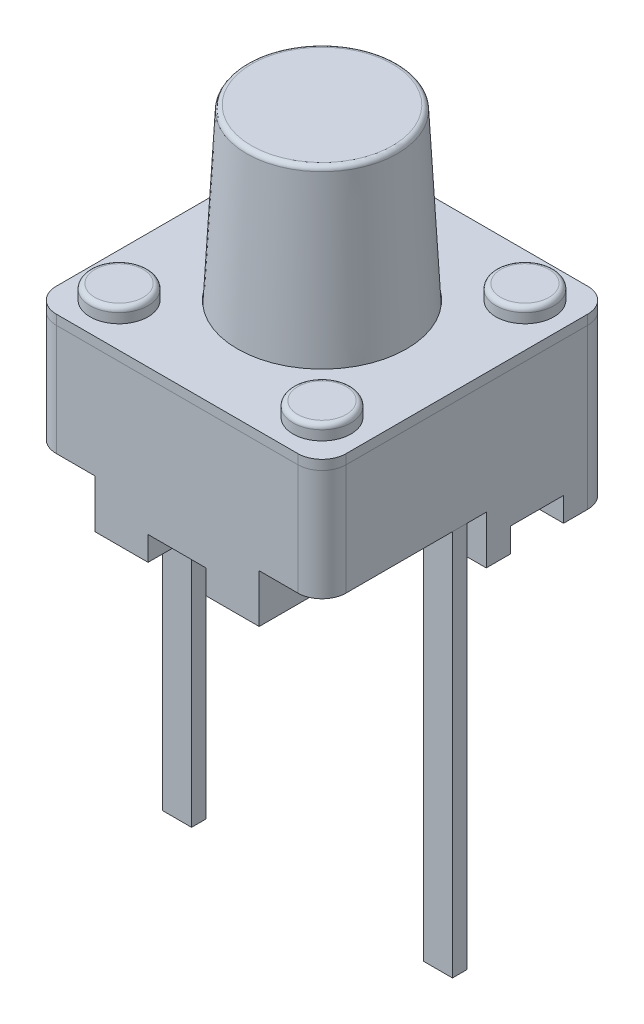
from build123d import *

# Parameters (mm, degrees)
SKETCH1_W                 = 0.6
SKETCH1_H                 = 0.3
SKETCH1_R                 = 0.6
SKETCH1_R_2               = 1.75
BASE_DEPTH                = 3.3
TOP_START                 = 3.3
SKETCH1_3_R               = 0.6
SKETCH1_3_R_2             = 1.75
SKETCH1_3_W               = 0.6
SKETCH1_3_H               = 0.3
TOP_PLATE_DEPTH           = 0.2
KNOBS_START               = 3.3
SKETCH1_4_R               = 0.6
KNOBS_DEPTH               = 0.5
ACTUATOR_START            = 3.3
SKETCH1_5_R               = 1.75
ACTUATOR_DEPTH            = 3.7
ACTUATOR_TAPER            = 3
BASE_LEG_CUTOUT_DEPTH     = 1
SKETCH2_3_W               = 1.2
SKETCH2_3_H               = 6
SKETCH2_3_W_2             = 1.3
SKETCH2_3_H_2             = 1.1
BASE_SHALLOW_CUTOUT_DEPTH = 0.5
PINS_START                = 1
SKETCH1_7_W               = 0.6
SKETCH1_7_H               = 0.3
PINS_DEPTH                = 8
PINS_2_DEPTH              = 8
FILLET1_R                 = 0.1
FILLET2_R                 = 0.1


with BuildPart() as part:
    # Sketch1 → Base (new body)
    # profile 1 of 8: a face of its own
    with BuildSketch(Plane(origin=(0, 0, 0), x_dir=(1, 0, 0), z_dir=(0, 1, 0))):
        with Locations((-2.7, -0.15)):
            Rectangle(SKETCH1_W, SKETCH1_H)
    # profile 2 of 8: a face of its own
    with BuildSketch(Plane(origin=(0, 0, 0), x_dir=(1, 0, 0), z_dir=(0, 1, 0))):
        with BuildLine():
            Line((2.5, 3), (-2.5, 3))
            ThreePointArc((-2.5, 3), (-2.853553391, 2.853553391), (-3, 2.5))
            Line((-3, 2.5), (-3, 0))
            Line((-3, 0), (-2.4, 0))
            Line((-2.4, 0), (-2.4, -0.3))
            Line((-2.4, -0.3), (-3, -0.3))
            Line((-3, -0.3), (-3, -2.5))
            ThreePointArc((-3, -2.5), (-2.853553391, -2.853553391), (-2.5, -3))
            Line((-2.5, -3), (2.5, -3))
            ThreePointArc((2.5, -3), (2.853553391, -2.853553391), (3, -2.5))
            Line((3, -2.5), (3, -0.3))
            Line((3, -0.3), (2.4, -0.3))
            Line((2.4, -0.3), (2.4, 0))
            Line((2.4, 0), (3, 0))
            Line((3, 0), (3, 2.5))
            ThreePointArc((3, 2.5), (2.853553391, 2.853553391), (2.5, 3))
        make_face()
        with Locations((-2.1, -2.1)):
            Circle(SKETCH1_R, mode=Mode.SUBTRACT)
        Circle(SKETCH1_R_2, mode=Mode.SUBTRACT)
        with Locations((2.1, -2.1)):
            Circle(SKETCH1_R, mode=Mode.SUBTRACT)
        with Locations((-2.1, 2.1)):
            Circle(SKETCH1_R, mode=Mode.SUBTRACT)
        with Locations((2.1, 2.1)):
            Circle(SKETCH1_R, mode=Mode.SUBTRACT)
    # profile 3 of 8: a face of its own
    with BuildSketch(Plane(origin=(0, 0, 0), x_dir=(1, 0, 0), z_dir=(0, 1, 0))):
        with Locations((-2.1, 2.1)):
            Circle(SKETCH1_R)
    # profile 4 of 8: a face of its own
    with BuildSketch(Plane(origin=(0, 0, 0), x_dir=(1, 0, 0), z_dir=(0, 1, 0))):
        with Locations((-2.1, -2.1)):
            Circle(SKETCH1_R)
    # profile 5 of 8: a face of its own
    with BuildSketch(Plane(origin=(0, 0, 0), x_dir=(1, 0, 0), z_dir=(0, 1, 0))):
        Circle(SKETCH1_R_2)
    # profile 6 of 8: a face of its own
    with BuildSketch(Plane(origin=(0, 0, 0), x_dir=(1, 0, 0), z_dir=(0, 1, 0))):
        with Locations((2.1, -2.1)):
            Circle(SKETCH1_R)
    # profile 7 of 8: a face of its own
    with BuildSketch(Plane(origin=(0, 0, 0), x_dir=(1, 0, 0), z_dir=(0, 1, 0))):
        with Locations((2.7, -0.15)):
            Rectangle(SKETCH1_W, SKETCH1_H)
    # profile 8 of 8: a face of its own
    with BuildSketch(Plane(origin=(0, 0, 0), x_dir=(1, 0, 0), z_dir=(0, 1, 0))):
        with Locations((2.1, 2.1)):
            Circle(SKETCH1_R)
    extrude(amount=BASE_DEPTH)

    # Sketch1<4> → Knobs (add)
    with BuildSketch(Plane(origin=(0, 0, 0), x_dir=(1, 0, 0), z_dir=(0, 1, 0)).offset(KNOBS_START)):
        with Locations(Location((2.1, -2.1, 0), (0, 0, 270))):
            Circle(SKETCH1_4_R)
        with Locations(Location((-2.1, -2.1, 0), (0, 0, 270))):
            Circle(SKETCH1_4_R)
        with Locations(Location((-2.1, 2.1, 0), (0, 0, 270))):
            Circle(SKETCH1_4_R)
        with Locations(Location((2.1, 2.1, 0), (0, 0, 270))):
            Circle(SKETCH1_4_R)
    extrude(amount=KNOBS_DEPTH)

    # Sketch2 → Base Leg Cutout (cut)
    with BuildSketch(Plane.XZ):
        with BuildLine():
            Line((-1.7, -0.4), (-1.7, 3))
            Line((-1.7, 3), (-2.5, 3))
            ThreePointArc((-2.5, 3), (-2.853553391, 2.853553391), (-3, 2.5))
            Line((-3, 2.5), (-3, -0.4))
            Line((-3, -0.4), (-1.7, -0.4))
        make_face()
        with BuildLine():
            Line((2.5, 3), (1.7, 3))
            Line((1.7, 3), (1.7, -0.4))
            Line((1.7, -0.4), (3, -0.4))
            Line((3, -0.4), (3, 2.5))
            ThreePointArc((3, 2.5), (2.853553391, 2.853553391), (2.5, 3))
        make_face()
    extrude(amount=-BASE_LEG_CUTOUT_DEPTH, mode=Mode.SUBTRACT)

    # Sketch2<3> → Base Shallow Cutout (cut)
    with BuildSketch(Plane.XZ):
        Rectangle(SKETCH2_3_W, SKETCH2_3_H)
        with Locations((2.35, -1.45)):
            Rectangle(SKETCH2_3_W_2, SKETCH2_3_H_2)
        with Locations((-2.35, -1.45)):
            Rectangle(SKETCH2_3_W_2, SKETCH2_3_H_2)
    extrude(amount=-BASE_SHALLOW_CUTOUT_DEPTH, mode=Mode.SUBTRACT)

    # Fillet2
    fillet2_edges = [part.edges().sort_by_distance(p)[0] for p in [
        (2.1, 3.8, 1.5),
        (-2.1, 3.8, 1.5),
        (-2.1, 3.8, -2.7),
        (2.1, 3.8, -2.7),
    ]]
    fillet(fillet2_edges, radius=FILLET2_R)


with BuildPart() as body_2:
    # Sketch1<3> → Top Plate (new body)
    # profile 1 of 3: a face of its own
    with BuildSketch(Plane(origin=(0, 0, 0), x_dir=(1, 0, 0), z_dir=(0, 1, 0)).offset(TOP_START)):
        with BuildLine():
            Line((2.5, 3), (-2.5, 3))
            ThreePointArc((-2.5, 3), (-2.853553391, 2.853553391), (-3, 2.5))
            Line((-3, 2.5), (-3, 0))
            Line((-3, 0), (-2.4, 0))
            Line((-2.4, 0), (-2.4, -0.3))
            Line((-2.4, -0.3), (-3, -0.3))
            Line((-3, -0.3), (-3, -2.5))
            ThreePointArc((-3, -2.5), (-2.853553391, -2.853553391), (-2.5, -3))
            Line((-2.5, -3), (2.5, -3))
            ThreePointArc((2.5, -3), (2.853553391, -2.853553391), (3, -2.5))
            Line((3, -2.5), (3, -0.3))
            Line((3, -0.3), (2.4, -0.3))
            Line((2.4, -0.3), (2.4, 0))
            Line((2.4, 0), (3, 0))
            Line((3, 0), (3, 2.5))
            ThreePointArc((3, 2.5), (2.853553391, 2.853553391), (2.5, 3))
        make_face()
        with Locations(Location((-2.1, -2.1, 0), (0, 0, 270))):
            Circle(SKETCH1_3_R, mode=Mode.SUBTRACT)
        with Locations(Location((0, 0, 0), (0, 0, 270))):
            Circle(SKETCH1_3_R_2, mode=Mode.SUBTRACT)
        with Locations(Location((2.1, -2.1, 0), (0, 0, 270))):
            Circle(SKETCH1_3_R, mode=Mode.SUBTRACT)
        with Locations(Location((-2.1, 2.1, 0), (0, 0, 270))):
            Circle(SKETCH1_3_R, mode=Mode.SUBTRACT)
        with Locations(Location((2.1, 2.1, 0), (0, 0, 270))):
            Circle(SKETCH1_3_R, mode=Mode.SUBTRACT)
    # profile 2 of 3: a face of its own
    with BuildSketch(Plane(origin=(0, 0, 0), x_dir=(1, 0, 0), z_dir=(0, 1, 0)).offset(TOP_START)):
        with Locations((2.7, -0.15)):
            Rectangle(SKETCH1_3_W, SKETCH1_3_H)
    # profile 3 of 3: a face of its own
    with BuildSketch(Plane(origin=(0, 0, 0), x_dir=(1, 0, 0), z_dir=(0, 1, 0)).offset(TOP_START)):
        with Locations((-2.7, -0.15)):
            Rectangle(SKETCH1_3_W, SKETCH1_3_H)
    extrude(amount=TOP_PLATE_DEPTH)


with BuildPart() as body_3:
    # Sketch1<5> → Actuator (new body)
    with BuildSketch(Plane(origin=(0, 0, 0), x_dir=(1, 0, 0), z_dir=(0, 1, 0)).offset(ACTUATOR_START)):
        with Locations(Location((0, 0, 0), (0, 0, 270))):
            Circle(SKETCH1_5_R)
    extrude(amount=ACTUATOR_DEPTH, taper=ACTUATOR_TAPER)

    # Fillet1
    fillet1_edges = [body_3.edges().sort_by_distance(p)[0] for p in [
        (0, 7, -1.556091217),
    ]]
    fillet(fillet1_edges, radius=FILLET1_R)


with BuildPart() as body_4:
    # Sketch1<7> → Pins (new body)
    with BuildSketch(Plane(origin=(0, 0, 0), x_dir=(1, 0, 0), z_dir=(0, 1, 0)).offset(PINS_START)):
        with Locations((-2.7, -0.15)):
            Rectangle(SKETCH1_7_W, SKETCH1_7_H)
    extrude(amount=-PINS_DEPTH)


with BuildPart() as body_5:
    # Sketch1<7> → Pins 2 (new body)
    with BuildSketch(Plane(origin=(0, 0, 0), x_dir=(1, 0, 0), z_dir=(0, 1, 0)).offset(PINS_START)):
        with Locations((2.7, -0.15)):
            Rectangle(SKETCH1_7_W, SKETCH1_7_H)
    extrude(amount=-PINS_2_DEPTH)


solid = Compound([part.part, body_2.part, body_3.part, body_4.part, body_5.part])
